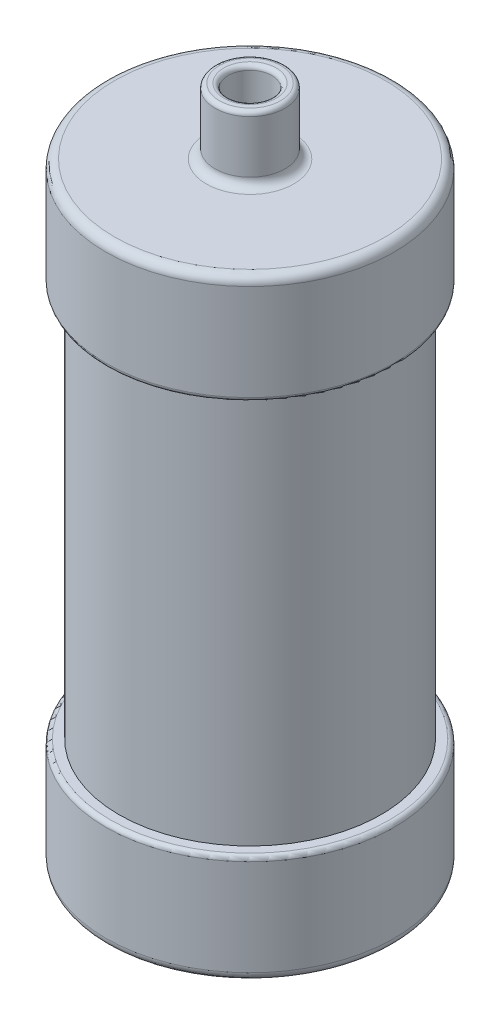
from build123d import *

# Parameters (mm, degrees)
EXTRUIR_L_MINA1_DEPTH      = 60
EXTRUIR_L_MINA1_DEPTH_BACK = 60
CROQUIS1_R                 = 30
CROQUIS1_R_2               = 27
CROQUIS2_R                 = 33
CROQUIS2_R_2               = 30
EXTRUIR1_DEPTH             = 15
CROQUIS3_R                 = 33
EXTRUIR2_DEPTH             = 10
CROQUIS4_R                 = 8
CROQUIS4_R_2               = 5
EXTRUIR3_DEPTH             = 15
CROQUIS5_R                 = 5
EXTRUIR4_DEPTH             = 20
REDONDEO1_R                = 2
REDONDEO2_R                = 1


with BuildPart() as part:
    # Croquis1 → Extruir-Lámina1 (new, two sides: drawn at the far end of the back side and taken through both)
    with BuildSketch(Plane(origin=(0, 0, 0), x_dir=(1, 0, 0), z_dir=(0, 1, 0)).offset(-EXTRUIR_L_MINA1_DEPTH_BACK)):
        Circle(CROQUIS1_R)
        Circle(CROQUIS1_R_2, mode=Mode.SUBTRACT)
    extrude(amount=EXTRUIR_L_MINA1_DEPTH + EXTRUIR_L_MINA1_DEPTH_BACK)


with BuildPart() as body_2:
    # Croquis2 → Extruir1 (new body)
    with BuildSketch(Plane(origin=(0, 60, 0), x_dir=(1, 0, 0), z_dir=(0, 1, 0))):
        with Locations(Location((0, 0, 0), (0, 0, 270))):
            Circle(CROQUIS2_R)
        with Locations(Location((0, 0, 0), (0, 0, 270))):
            Circle(CROQUIS2_R_2, mode=Mode.SUBTRACT)
    extrude(amount=-EXTRUIR1_DEPTH)

    # Croquis3 → Extruir2 (add)
    with BuildSketch(Plane(origin=(0, 60, 0), x_dir=(1, 0, 0), z_dir=(0, 1, 0))):
        with Locations(Location((0, 0, 0), (0, 0, 270))):
            Circle(CROQUIS3_R)
    extrude(amount=EXTRUIR2_DEPTH)

    # Croquis4 → Extruir3 (add)
    with BuildSketch(Plane(origin=(0, 70, 0), x_dir=(1, 0, 0), z_dir=(0, 1, 0))):
        with Locations(Location((0, 0, 0), (0, 0, 270))):
            Circle(CROQUIS4_R)
        with Locations(Location((0, 0, 0), (0, 0, 270))):
            Circle(CROQUIS4_R_2, mode=Mode.SUBTRACT)
    extrude(amount=EXTRUIR3_DEPTH)

    # Croquis5 → Extruir4 (cut)
    with BuildSketch(Plane(origin=(0, 70, 0), x_dir=(1, 0, 0), z_dir=(0, 1, 0))):
        with Locations(Location((0, 0, 0), (0, 0, 270))):
            Circle(CROQUIS5_R)
    extrude(amount=-EXTRUIR4_DEPTH, mode=Mode.SUBTRACT)

    # Redondeo1
    redondeo1_edges = [body_2.edges().sort_by_distance(p)[0] for p in [
        (0, 70, -33),
        (0, 70, -8),
    ]]
    fillet(redondeo1_edges, radius=REDONDEO1_R)

    # Redondeo2
    redondeo2_edges = [body_2.edges().sort_by_distance(p)[0] for p in [
        (0, 85, -8),
        (0, 85, -5),
        (0, 45, -33),
    ]]
    fillet(redondeo2_edges, radius=REDONDEO2_R)


with BuildPart() as body_3:
    # Simetría1: mirrored copy
    add(body_2.part.mirror(Plane.ZX))


solid = Compound([part.part, body_2.part, body_3.part])
